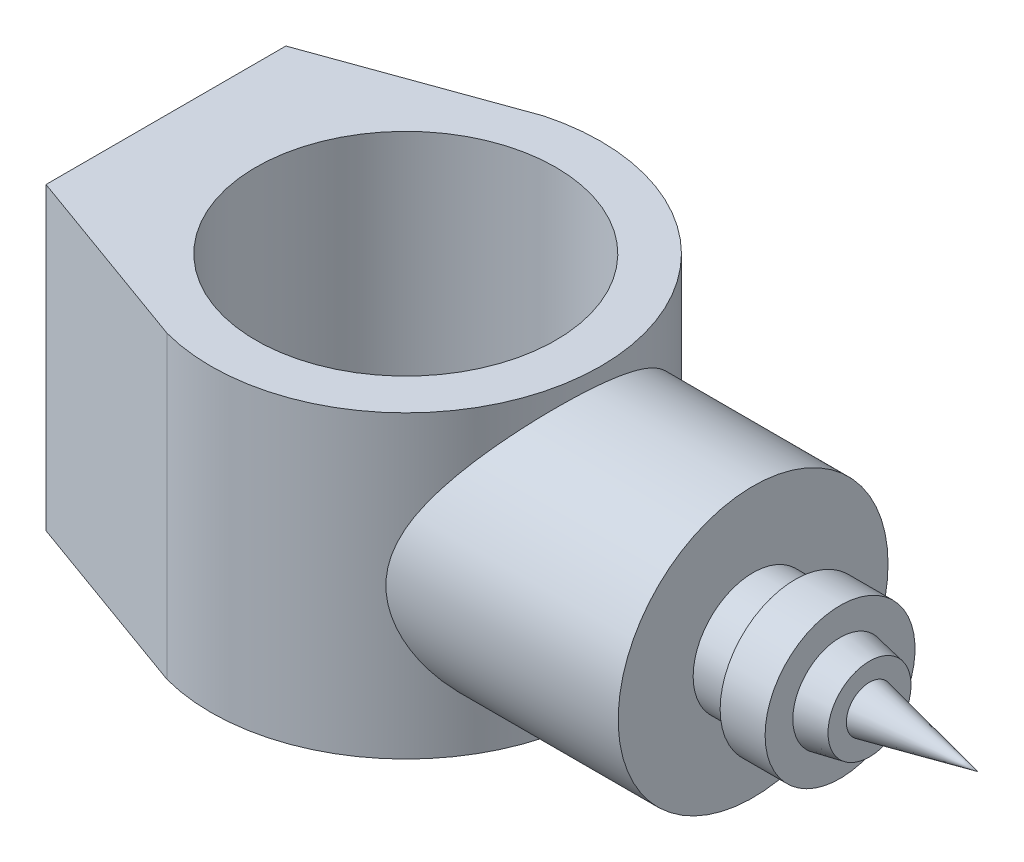
from build123d import *

# Parameters (mm, degrees)
SKETCH1_R                = 1270
BOSS_EXTRUDE1_DEPTH      = 1270
BOSS_EXTRUDE4_REACH      = 5525.249
BOSS_EXTRUDE4_END_RADIUS = 1651
SKETCH4_R                = 1143


with BuildPart() as part:
    # Sketch1 → Boss-Extrude1 (new, symmetric)
    with BuildSketch(Plane(origin=(0, 0, 0), x_dir=(1, 0, 0), z_dir=(0, 1, 0))):
        with BuildLine():
            Line((-2032, 1121.981561932), (-428.04363425, 1700.528408901))
            ThreePointArc((-428.04363425, 1700.528408901), (1651, 105.981561932), (-428.04363425, -1488.565285037))
            Line((-428.04363425, -1488.565285037), (-2032, -910.018438068))
            Line((-2032, -910.018438068), (-2032, 1121.981561932))
        make_face()
        with Locations(Location((0, 105.981561932, 0), (0, 0, 90))):
            Circle(SKETCH1_R, mode=Mode.SUBTRACT)
    extrude(amount=BOSS_EXTRUDE1_DEPTH, both=True)

    # Boss-Extrude4: up to this cylinder (the profile starts outside it)
    boss_extrude4_end = Plane(origin=(0, 0, -105.981561932), z_dir=(0, -1, 0)) * Cylinder(BOSS_EXTRUDE4_END_RADIUS, 14353.498, mode=Mode.PRIVATE)
    # Sketch4 → Boss-Extrude4 (add, up to the surface)
    with BuildSketch(Plane(origin=(3048, 0, 0), x_dir=(0, 0, -1), z_dir=(1, 0, 0)), mode=Mode.PRIVATE) as boss_extrude4_sk1:
        Circle(SKETCH4_R)
    boss_extrude4_tool1 = extrude(boss_extrude4_sk1.sketch, amount=-BOSS_EXTRUDE4_REACH, mode=Mode.PRIVATE) - boss_extrude4_end
    add(boss_extrude4_tool1.solids().sort_by_distance((3048, 0, 0))[0])

    # Sketch8 → Revolve3 (revolve)
    with BuildSketch(Plane(origin=(0, 0, 0), x_dir=(1, 0, 0), z_dir=(0, 1, 0))):
        Polygon((3048, 0), (3048, -508), (3403.6, -508), (3403.6, -635), (3784.6, -635), (3784.6, -400.036853536), (4033.952135237, -351.668344643), (4033.952135237, -196.405351951), (4953, 0), align=None)
    revolve(axis=Axis((0, 0, 0), (1, 0, 0)))


solid = part.part
